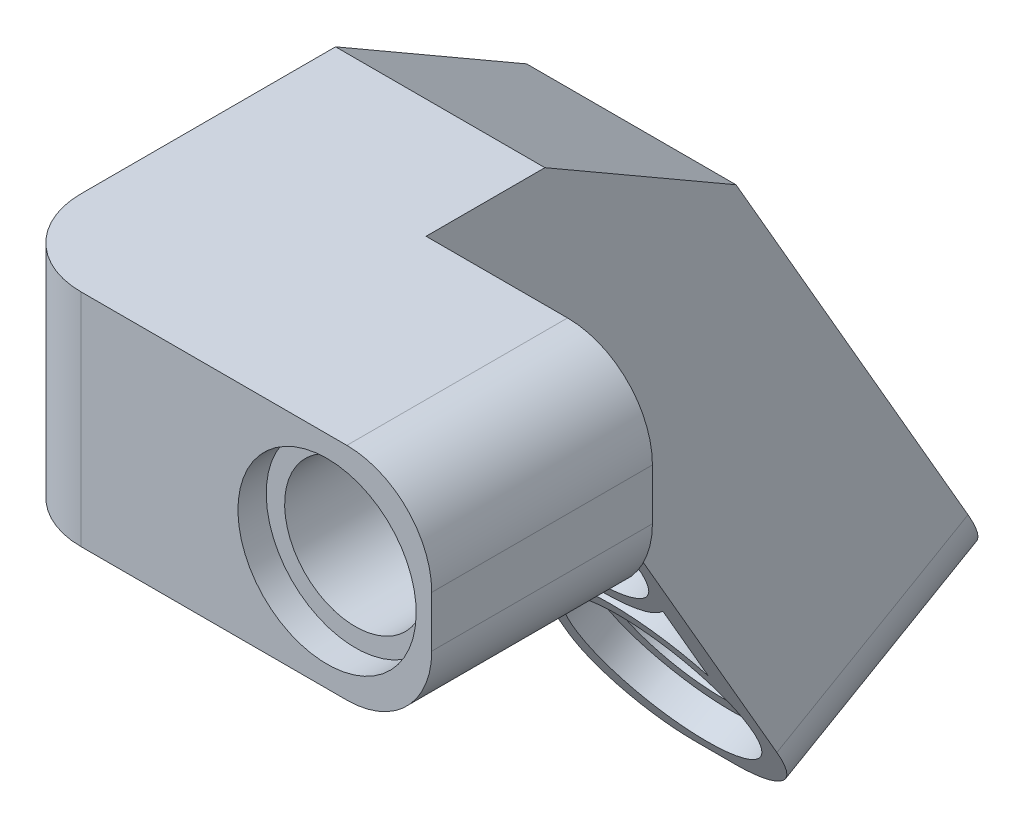
from build123d import *

# Parameters (mm, degrees)
EXTRUDE_1_DEPTH        = 7.4
EXTRUDE_2_DEPTH        = 7.8
CUT_EXTRUDE_1_REACH    = 32.758
SKETCH_4_R             = 2.5000000000000004
SKETCH_4_3_R           = 3.1499999999999972
CUT_EXTRUDE_2_DEPTH    = 1
CUT_EXTRUDE_START      = -6.8
SKETCH_4_4_R           = 3.1499999999999972
CUT_EXTRUDE_3_DEPTH    = 1
CUT_EXTRUDE_4_DEPTH    = 1
CUT_EXTRUDE_5_DEPTH    = 1
CUT_EXTRUDE_6_REACH    = 33.897
PATTERN_LINEAR_1_COUNT = 2
PATTERN_LINEAR_1_PITCH = 8
CUT_EXTRUDE_7_DEPTH    = 2
CUT_EXTRUDE_START_2    = -5.8
CUT_EXTRUDE_8_DEPTH    = 2
FILLET_1_R             = 3
PATTERN_LINEAR_3_COUNT = 2
PATTERN_LINEAR_3_PITCH = 8


with BuildPart() as part:
    # 草图1 → 凸台-拉伸1 (new body)
    with BuildSketch(Plane(origin=(0, 0, 0), x_dir=(0, 0, -1), z_dir=(1, 0, 0))):
        Polygon((-6.94e-15, 7.800000000000002), (0, 0), (-12, 0), (-12.000000000000002, 7.8), align=None)
        Polygon((-6.94e-15, 7.800000000000002), (0, 0), (6.754998149518629, 3.8999999999999866), align=None)
        Polygon((0, 0), (9.699999999999958, -16.800892833418125), (16.45499814951859, -12.90089283341814), (6.754998149518629, 3.8999999999999866), align=None)
    extrude(amount=EXTRUDE_1_DEPTH)

    # 草图2 → 凸台-拉伸2 (add)
    with BuildSketch(Plane(origin=(0, 7.800000000000002, 1.13e-15), x_dir=(1, 0, 0), z_dir=(0, 1, 2.3e-16))):
        Polygon((7.400000000000001, -12), (15.4, -11.999999999999998), (15.399999999999997, -4.199999999999999), (7.4, -4.2), align=None)
    extrude(amount=-EXTRUDE_2_DEPTH)

    # 草图4 → 切除-拉伸1 (cut, up to next)
    with BuildSketch(Plane(origin=(0, -9.5e-16, 4.199999999999999), x_dir=(-1, 0, 0), z_dir=(0, 2.3e-16, -1)), mode=Mode.PRIVATE) as cut_extrude_1_sk1:
        with Locations(Location((-11.70000000000001, 3.9000000000000017, 0), (0, 0, 90))):
            Circle(SKETCH_4_R)
    cut_extrude_1_tool1 = extrude(cut_extrude_1_sk1.sketch, amount=-CUT_EXTRUDE_1_REACH, mode=Mode.PRIVATE) & part.part
    add(cut_extrude_1_tool1.solids().sort_by_distance((11.7, 3.9, 4.2))[0], mode=Mode.SUBTRACT)

    # 草图4<3> → 切除-拉伸2 (cut)
    with BuildSketch(Plane(origin=(0, -9.5e-16, 4.199999999999999), x_dir=(-1, 0, 0), z_dir=(0, 2.3e-16, -1))):
        with Locations(Location((-11.70000000000001, 3.9000000000000017, 0), (0, 0, 90))):
            Circle(SKETCH_4_3_R)
    extrude(amount=-CUT_EXTRUDE_2_DEPTH, mode=Mode.SUBTRACT)

    # 草图4<4> → 切除-拉伸3 (cut)
    with BuildSketch(Plane(origin=(0, -9.5e-16, 4.199999999999999), x_dir=(-1, 0, 0), z_dir=(0, 2.3e-16, -1)).offset(CUT_EXTRUDE_START)):
        with Locations(Location((-11.70000000000001, 3.9000000000000017, 0), (0, 0, 90))):
            Circle(SKETCH_4_4_R)
    extrude(amount=-CUT_EXTRUDE_3_DEPTH, mode=Mode.SUBTRACT)

    # 草图5 → 切除-拉伸4 (cut)
    with BuildSketch(Plane(origin=(0, 3.8999999999999857, -6.754998149518631), x_dir=(1, 0, 0), z_dir=(0, 0.499999999999998, -0.8660254037844397))):
        with BuildLine():
            ThreePointArc((6.85, 15.699999999999992), (5.927386360737607, 17.927386360737636), (3.6999999999999518, 18.84999999999999))
            Line((3.7000000000000024, 18.84999999999999), (3.7000000000000024, 18.199999999999992))
            ThreePointArc((3.6999999999999913, 18.199999999999992), (5.4677669529663655, 17.467766952966365), (6.199999999999999, 15.699999999999992))
            ThreePointArc((6.199999999999999, 15.699999999999992), (5.467766952966364, 13.93223304703362), (3.699999999999989, 13.199999999999992))
            Line((3.7000000000000024, 13.199999999999992), (3.7000000000000024, 12.549999999999994))
            ThreePointArc((3.6999999999999496, 12.549999999999994), (5.927386360737607, 13.472613639262349), (6.85, 15.699999999999992))
        make_face()
        with BuildLine():
            Line((3.7000000000000024, 18.199999999999992), (3.7000000000000024, 18.84999999999999))
            ThreePointArc((3.6999999999999513, 18.84999999999999), (0.5500000000000012, 15.699999999999992), (3.6999999999999496, 12.549999999999994))
            Line((3.7000000000000024, 12.549999999999994), (3.7000000000000024, 13.199999999999992))
            ThreePointArc((3.699999999999989, 13.199999999999992), (1.2000000000000015, 15.699999999999992), (3.6999999999999913, 18.199999999999992))
        make_face()
    cut_extrude_4 = extrude(amount=-CUT_EXTRUDE_4_DEPTH, mode=Mode.SUBTRACT)

    # 草图5<3> → 切除-拉伸5 (cut)
    with BuildSketch(Plane(origin=(0, 3.8999999999999857, -6.754998149518631), x_dir=(1, 0, 0), z_dir=(0, 0.499999999999998, -0.8660254037844397)).offset(CUT_EXTRUDE_START)):
        with BuildLine():
            ThreePointArc((6.85, 15.699999999999992), (5.927386360737607, 17.927386360737636), (3.6999999999999518, 18.84999999999999))
            Line((3.7000000000000024, 18.84999999999999), (3.7000000000000024, 18.199999999999992))
            ThreePointArc((3.6999999999999913, 18.199999999999992), (5.4677669529663655, 17.467766952966365), (6.199999999999999, 15.699999999999992))
            ThreePointArc((6.199999999999999, 15.699999999999992), (5.467766952966364, 13.93223304703362), (3.699999999999989, 13.199999999999992))
            Line((3.7000000000000024, 13.199999999999992), (3.7000000000000024, 12.549999999999994))
            ThreePointArc((3.6999999999999496, 12.549999999999994), (5.927386360737607, 13.472613639262349), (6.85, 15.699999999999992))
        make_face()
        with BuildLine():
            Line((3.7000000000000024, 18.199999999999992), (3.7000000000000024, 18.84999999999999))
            ThreePointArc((3.6999999999999513, 18.84999999999999), (0.5500000000000012, 15.699999999999992), (3.6999999999999496, 12.549999999999994))
            Line((3.7000000000000024, 12.549999999999994), (3.7000000000000024, 13.199999999999992))
            ThreePointArc((3.699999999999989, 13.199999999999992), (1.2000000000000015, 15.699999999999992), (3.6999999999999913, 18.199999999999992))
        make_face()
    cut_extrude_5 = extrude(amount=-CUT_EXTRUDE_5_DEPTH, mode=Mode.SUBTRACT)

    # 草图5<4> → 切除-拉伸6 (cut, up to next)
    with BuildSketch(Plane(origin=(0, 3.8999999999999857, -6.754998149518631), x_dir=(1, 0, 0), z_dir=(0, 0.499999999999998, -0.8660254037844397)), mode=Mode.PRIVATE) as cut_extrude_6_sk1:
        with BuildLine():
            ThreePointArc((6.199999999999999, 15.699999999999992), (5.4677669529663655, 17.467766952966365), (3.6999999999999913, 18.199999999999992))
            Line((3.7000000000000024, 18.199999999999992), (3.7000000000000024, 13.199999999999992))
            ThreePointArc((3.699999999999989, 13.199999999999992), (5.467766952966364, 13.93223304703362), (6.199999999999999, 15.699999999999992))
        make_face()
    cut_extrude_6_tool1 = extrude(cut_extrude_6_sk1.sketch, amount=-CUT_EXTRUDE_6_REACH, mode=Mode.PRIVATE) & part.part
    # 草图5<4> → 切除-拉伸6 (cut, up to next)
    with BuildSketch(Plane(origin=(0, 3.8999999999999857, -6.754998149518631), x_dir=(1, 0, 0), z_dir=(0, 0.499999999999998, -0.8660254037844397)), mode=Mode.PRIVATE) as cut_extrude_6_sk2:
        with BuildLine():
            Line((3.7000000000000024, 13.199999999999992), (3.7000000000000024, 18.199999999999992))
            ThreePointArc((3.6999999999999913, 18.199999999999992), (1.2000000000000015, 15.699999999999992), (3.699999999999989, 13.199999999999992))
        make_face()
    cut_extrude_6_tool2 = extrude(cut_extrude_6_sk2.sketch, amount=-CUT_EXTRUDE_6_REACH, mode=Mode.PRIVATE) & part.part
    # 草图5<4> → 切除-拉伸6 (cut, up to next)
    with BuildSketch(Plane(origin=(0, 3.8999999999999857, -6.754998149518631), x_dir=(1, 0, 0), z_dir=(0, 0.499999999999998, -0.8660254037844397)), mode=Mode.PRIVATE) as cut_extrude_6_sk3:
        with BuildLine():
            ThreePointArc((6.199999999999999, 15.699999999999992), (5.4677669529663655, 17.467766952966365), (3.6999999999999913, 18.199999999999992))
            Line((3.7000000000000024, 18.199999999999992), (3.7000000000000024, 13.199999999999992))
            ThreePointArc((3.699999999999989, 13.199999999999992), (5.467766952966364, 13.93223304703362), (6.199999999999999, 15.699999999999992))
        make_face()
    cut_extrude_6_tool3 = extrude(cut_extrude_6_sk3.sketch, amount=-CUT_EXTRUDE_6_REACH, mode=Mode.PRIVATE) & part.part
    # 草图5<4> → 切除-拉伸6 (cut, up to next)
    with BuildSketch(Plane(origin=(0, 3.8999999999999857, -6.754998149518631), x_dir=(1, 0, 0), z_dir=(0, 0.499999999999998, -0.8660254037844397)), mode=Mode.PRIVATE) as cut_extrude_6_sk4:
        with BuildLine():
            Line((3.7000000000000024, 13.199999999999992), (3.7000000000000024, 18.199999999999992))
            ThreePointArc((3.6999999999999913, 18.199999999999992), (1.2000000000000015, 15.699999999999992), (3.699999999999989, 13.199999999999992))
        make_face()
    cut_extrude_6_tool4 = extrude(cut_extrude_6_sk4.sketch, amount=-CUT_EXTRUDE_6_REACH, mode=Mode.PRIVATE) & part.part
    cut_extrude_6_1 = cut_extrude_6_tool1.solids().sort_by_distance((4.761033, -9.696599, -14.604998))[0]
    add(cut_extrude_6_1, mode=Mode.SUBTRACT)
    cut_extrude_6_2 = cut_extrude_6_tool2.solids().sort_by_distance((2.638967, -9.696599, -14.604998))[0]
    add(cut_extrude_6_2, mode=Mode.SUBTRACT)
    cut_extrude_6_3 = cut_extrude_6_tool3.solids().sort_by_distance((4.761033, -9.696599, -14.604998))[0]
    add(cut_extrude_6_3, mode=Mode.SUBTRACT)
    cut_extrude_6_4 = cut_extrude_6_tool4.solids().sort_by_distance((2.638967, -9.696599, -14.604998))[0]
    add(cut_extrude_6_4, mode=Mode.SUBTRACT)
    cut_extrude_6 = cut_extrude_6_1 + cut_extrude_6_2 + cut_extrude_6_3 + cut_extrude_6_4  # 切除-拉伸6 as one shape, for the pattern or mirror that repeats it

    # 阵列(线性)1: 切除-拉伸4, 切除-拉伸5, 切除-拉伸6 ×2
    with Locations(*[Vector(0, 0.8660254037844397, 0.49999999999999806) * (i * PATTERN_LINEAR_1_PITCH) for i in range(1, PATTERN_LINEAR_1_COUNT)]):
        add(cut_extrude_4, mode=Mode.SUBTRACT)
        add(cut_extrude_5, mode=Mode.SUBTRACT)
        add(cut_extrude_6, mode=Mode.SUBTRACT)

    # 草图6 → 切除-拉伸7 (cut)
    with BuildSketch(Plane(origin=(0, 3.899999999999984, -6.754998149518628), x_dir=(1, 0, 0), z_dir=(0, 0.49999999999999806, -0.8660254037844398))):
        with BuildLine():
            Line((6.525000000000001, 10.089429848311095), (6.525, 13.31057015168897))
            ThreePointArc((6.52500000000005, 13.310570151688953), (3.699999999999908, 11.999999999999995), (0.8749999999998344, 13.310570151689092))
            Line((0.8750000000000009, 13.310570151689145), (0.8750000000000012, 10.089429848311095))
            ThreePointArc((0.8750000000000027, 10.089429848311095), (3.7000000000000015, 11.399999999999995), (6.525, 10.089429848311095))
        make_face()
    cut_extrude_7 = extrude(amount=-CUT_EXTRUDE_7_DEPTH, mode=Mode.SUBTRACT)

    # 草图6<3> → 切除-拉伸8 (cut)
    with BuildSketch(Plane(origin=(0, 3.899999999999984, -6.754998149518628), x_dir=(1, 0, 0), z_dir=(0, 0.49999999999999806, -0.8660254037844398)).offset(CUT_EXTRUDE_START_2)):
        with BuildLine():
            Line((6.525000000000001, 10.089429848311095), (6.525, 13.31057015168897))
            ThreePointArc((6.52500000000005, 13.310570151688953), (3.699999999999908, 11.999999999999995), (0.8749999999998344, 13.310570151689092))
            Line((0.8750000000000009, 13.310570151689145), (0.8750000000000012, 10.089429848311095))
            ThreePointArc((0.8750000000000027, 10.089429848311095), (3.7000000000000015, 11.399999999999995), (6.525, 10.089429848311095))
        make_face()
    extrude(amount=-CUT_EXTRUDE_8_DEPTH, mode=Mode.SUBTRACT)

    # 圆角1
    fillet_1_edges = [part.edges().sort_by_distance(p)[0] for p in [
        (0, -14.850892833418133, -13.077499074759274),
        (7.4, -14.850892833418133, -13.077499074759274),
        (15.399999999999999, 7.8, 8.1),
        (15.399999999999999, -5e-17, 8.099999999999998),
        (0, 3.9, 12),
    ]]
    fillet(fillet_1_edges, radius=FILLET_1_R)

    # 阵列(线性)3: 切除-拉伸7 ×2
    with Locations(*[Vector(0, 0.86602540378444, 0.4999999999999977) * (i * PATTERN_LINEAR_3_PITCH) for i in range(1, PATTERN_LINEAR_3_COUNT)]):
        add(cut_extrude_7, mode=Mode.SUBTRACT)


solid = part.part
